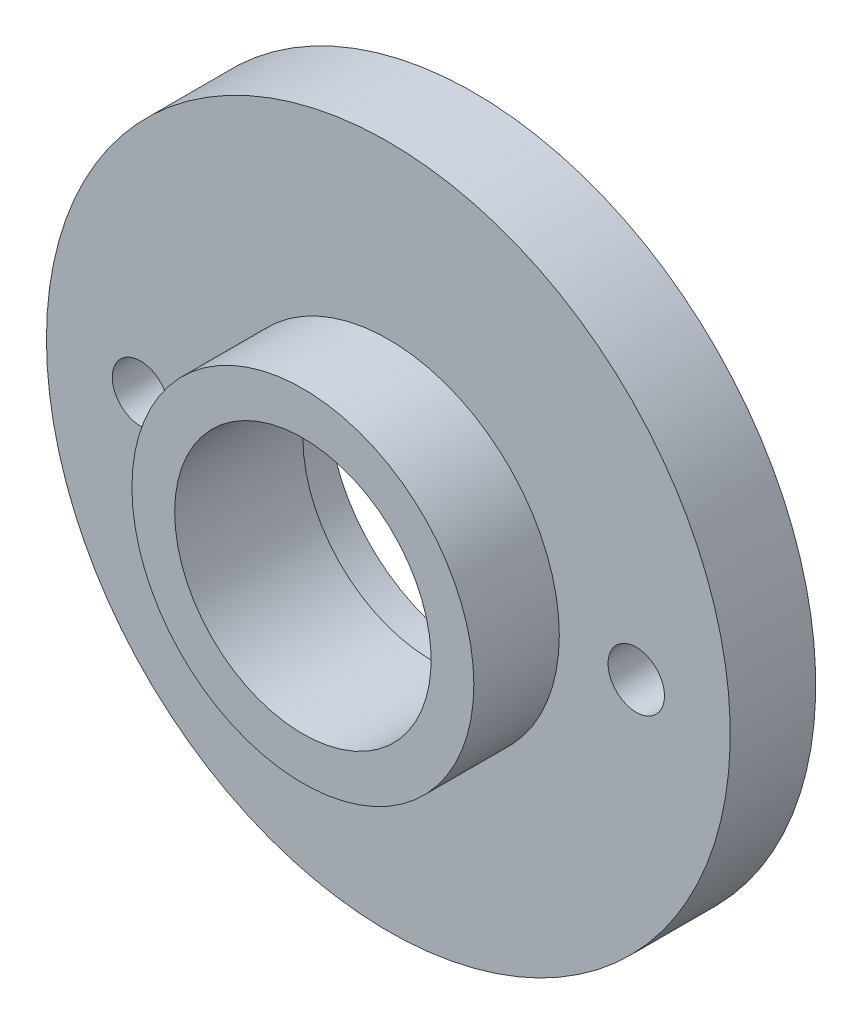
from build123d import *

# Parameters (mm, degrees)
M4X0_7_TAPPED_HOLE1_D = 3.3


with BuildPart() as part:
    # Sketch2 → Revolve1 (revolve)
    with BuildSketch(Plane(origin=(0, 0, 0), x_dir=(1, 0, 0), z_dir=(0, 1, 0)), mode=Mode.PRIVATE) as revolve1_sk:
        Polygon((7.5, -5), (10, -5), (10, 0), (20, 0), (20, 5), (8.5, 5), (8.5, 2.5), (7.5, 2.5), align=None)
    revolve(revolve1_sk.sketch.rotate(Axis((0, 0, -17.379705215), (0, 0, 1)), 180), axis=Axis((0, 0, -17.379705215), (0, 0, 1)))

    # M4x0.7 Tapped Hole1 (through all)
    with Locations(Plane.XY):
        with Locations((-14.5, 0), (14.5, 0)):
            Hole(M4X0_7_TAPPED_HOLE1_D / 2)


solid = part.part
